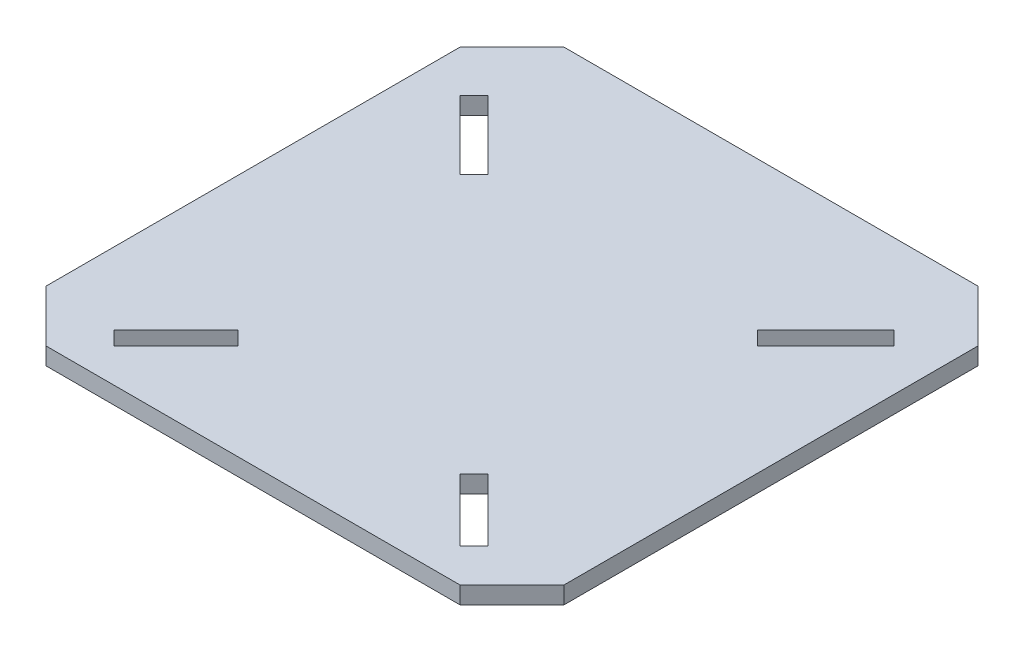
from build123d import *

# Parameters (mm, degrees)
EXTRUDE_1_DEPTH     = 1
CUT_EXTRUDE_1_DEPTH = 1


with BuildPart() as part:
    # 草图1 → 凸台-拉伸1 (new body)
    with BuildSketch(Plane(origin=(0, 0, 0), x_dir=(1, 0, 0), z_dir=(0, 1, 0))):
        Polygon((-27, 30), (-30, 27), (-30, 3), (-27, 0), (-3, 0), (0, 3), (0, 27), (-3, 30), align=None)
    extrude(amount=EXTRUDE_1_DEPTH)

    # 草图2 → 切除-拉伸1 (cut)
    with BuildSketch(Plane(origin=(0, 0, 0), x_dir=(1, 0, 0), z_dir=(0, 1, 0))):
        Polygon((-26.768491702, 25.375210501), (-27.571851102, 24.571851102), (-23.608439528, 20.608439528), (-22.805080129, 21.411798927), align=None)
        Polygon((-3.231508298, 25.375210501), (-2.428148898, 24.571851102), (-6.391560472, 20.608439528), (-7.194919871, 21.411798927), align=None)
        Polygon((-25.835128567, 2.771590231), (-25.031769168, 1.968230832), (-21.433586648, 5.566413352), (-22.236946047, 6.369772752), align=None)
        Polygon((-4.968230832, 1.968230832), (-4.164871433, 2.771590231), (-7.763215817, 6.369934615), (-8.566575216, 5.566575216), align=None)
    extrude(amount=CUT_EXTRUDE_1_DEPTH, mode=Mode.SUBTRACT)


solid = part.part
